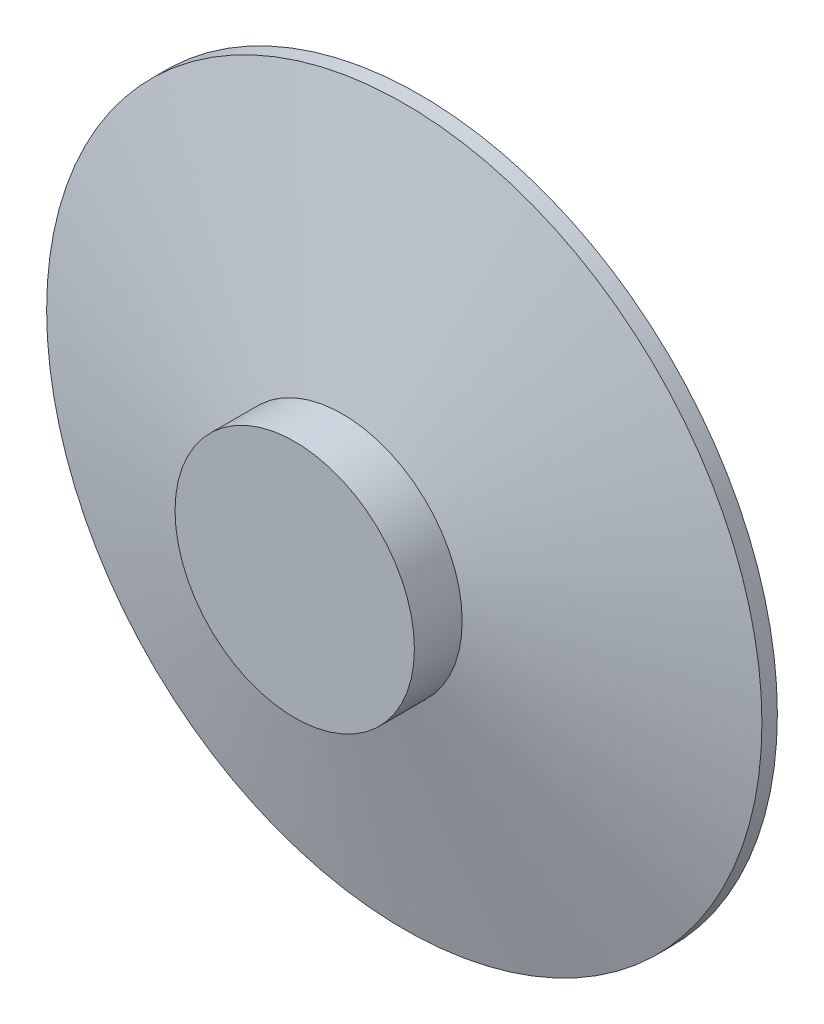
from build123d import *


with BuildPart() as part:
    # Sketch1 → Revolve1 (revolve)
    with BuildSketch(Plane(origin=(0, 0, 0), x_dir=(0, 0, -1), z_dir=(1, 0, 0)), mode=Mode.PRIVATE) as revolve1_sk:
        Polygon((0, 0), (0, 5.827395819), (2.326987445, 5.827395819), (5.334614326, 17.415605274), (6.086521046, 17.415605274), (6.086521046, 16.25), (4.494247992, 0), align=None)
    revolve(revolve1_sk.sketch.rotate(Axis((0, 0, 0), (0, 0, -1)), 90), axis=Axis((0, 0, 0), (0, 0, -1)))


solid = part.part
